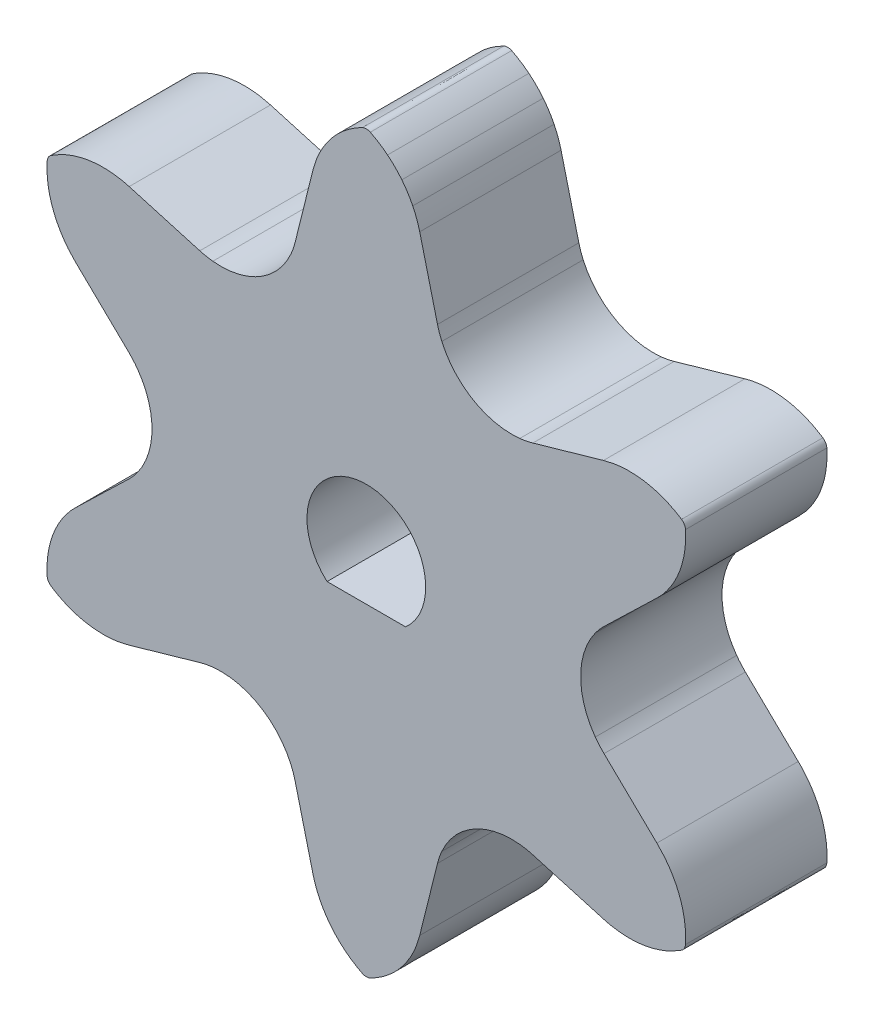
from build123d import *

# Parameters (mm, degrees)
BOSS_EXTRUDE1_DEPTH = 4.7625
CUT_EXTRUDE1_DEPTH  = 4.7625


with BuildPart() as part:
    # Sketch1 → Boss-Extrude1 (new body)
    with BuildSketch(Plane.XY):
        with BuildLine():
            ThreePointArc((0.13375119, -12.340042072), (1.193950707, -11.485860744), (1.798906697, -10.266157088))
            Line((1.798906697, -10.266157088), (2.398140588, -7.862761221))
            ThreePointArc((2.398140588, -7.862761221), (2.461635419, -7.64822635), (2.543491476, -7.440004377))
            ThreePointArc((2.543491476, -7.440004377), (3.61061, -6.253759966), (5.171487057, -5.922730421))
            ThreePointArc((5.171487057, -5.922730421), (5.392740604, -5.955951983), (5.610280667, -6.008231282))
            Line((5.610280667, -6.008231282), (7.991299489, -6.690977442))
            ThreePointArc((7.991299489, -6.690977442), (9.350071835, -6.776922016), (10.619914323, -6.285852964))
            ThreePointArc((10.619914323, -6.285852964), (10.714040096, -6.185753934), (10.753665513, -6.054189108))
            ThreePointArc((10.753665513, -6.054189108), (10.544022542, -4.708938729), (9.790206185, -3.575179646))
            Line((9.790206185, -3.575179646), (8.008421255, -1.854529939))
            ThreePointArc((8.008421255, -1.854529939), (7.854376023, -1.692274367), (7.714978533, -1.517273956))
            ThreePointArc((7.714978533, -1.517273956), (7.22122, 0), (7.714978533, 1.517273956))
            ThreePointArc((7.714978533, 1.517273956), (7.854376023, 1.692274367), (8.008421255, 1.854529939))
            Line((8.008421255, 1.854529939), (9.790205754, 3.575179229))
            ThreePointArc((9.790205754, 3.575179229), (10.544022434, 4.708938449), (10.753665513, 6.054189108))
            ThreePointArc((10.753665513, 6.054189108), (10.714040096, 6.185753934), (10.619914323, 6.285852964))
            ThreePointArc((10.619914323, 6.285852964), (9.350071835, 6.776922015), (7.991299489, 6.690977442))
            Line((7.991299489, 6.690977442), (5.610280667, 6.008231282))
            ThreePointArc((5.610280667, 6.008231282), (5.392740604, 5.955951983), (5.171487057, 5.922730421))
            ThreePointArc((5.171487057, 5.922730421), (3.61061, 6.253759966), (2.543491476, 7.440004377))
            ThreePointArc((2.543491476, 7.440004377), (2.461635419, 7.64822635), (2.398140588, 7.862761221))
            Line((2.398140588, 7.862761221), (1.798906697, 10.266157088))
            ThreePointArc((1.798906697, 10.266157088), (1.193950707, 11.485860744), (0.13375119, 12.340042072))
            ThreePointArc((0.13375119, 12.340042072), (0, 12.371507867), (-0.13375119, 12.340042072))
            ThreePointArc((-0.13375119, 12.340042072), (-1.193950707, 11.485860744), (-1.798906697, 10.266157088))
            Line((-1.798906697, 10.266157088), (-2.398140588, 7.862761221))
            ThreePointArc((-2.398140588, 7.862761221), (-2.461635419, 7.64822635), (-2.543491476, 7.440004377))
            ThreePointArc((-2.543491476, 7.440004377), (-3.61061, 6.253759966), (-5.171487057, 5.922730421))
            ThreePointArc((-5.171487057, 5.922730421), (-5.392740604, 5.955951983), (-5.610280667, 6.008231282))
            Line((-5.610280667, 6.008231282), (-7.991299489, 6.690977442))
            ThreePointArc((-7.991299489, 6.690977442), (-9.350071835, 6.776922016), (-10.619914323, 6.285852964))
            ThreePointArc((-10.619914323, 6.285852964), (-10.714040096, 6.185753934), (-10.753665513, 6.054189108))
            ThreePointArc((-10.753665513, 6.054189108), (-10.544022542, 4.708938729), (-9.790206185, 3.575179646))
            Line((-9.790206185, 3.575179646), (-8.008421255, 1.854529939))
            ThreePointArc((-8.008421255, 1.854529939), (-7.854376023, 1.692274367), (-7.714978533, 1.517273956))
            ThreePointArc((-7.714978533, 1.517273956), (-7.22122, 0), (-7.714978533, -1.517273956))
            ThreePointArc((-7.714978533, -1.517273956), (-7.854376023, -1.692274367), (-8.008421255, -1.854529939))
            Line((-8.008421255, -1.854529939), (-9.790205754, -3.575179229))
            ThreePointArc((-9.790205754, -3.575179229), (-10.544022434, -4.708938449), (-10.753665513, -6.054189108))
            ThreePointArc((-10.753665513, -6.054189108), (-10.714040096, -6.185753934), (-10.619914323, -6.285852964))
            ThreePointArc((-10.619914323, -6.285852964), (-9.350071835, -6.776922015), (-7.991299489, -6.690977442))
            Line((-7.991299489, -6.690977442), (-5.610280667, -6.008231282))
            ThreePointArc((-5.610280667, -6.008231282), (-5.392740604, -5.955951983), (-5.171487057, -5.922730421))
            ThreePointArc((-5.171487057, -5.922730421), (-3.61061, -6.253759966), (-2.543491476, -7.440004377))
            ThreePointArc((-2.543491476, -7.440004377), (-2.461635419, -7.64822635), (-2.398140588, -7.862761221))
            Line((-2.398140588, -7.862761221), (-1.798906697, -10.266157088))
            ThreePointArc((-1.798906697, -10.266157088), (-1.193950707, -11.485860744), (-0.13375119, -12.340042072))
            ThreePointArc((-0.13375119, -12.340042072), (0, -12.371507867), (0.13375119, -12.340042072))
        make_face()
        with BuildLine():
            Line((1.313392554, -1.475), (-1.313392554, -1.475))
            ThreePointArc((-1.313392554, -1.475), (0, 1.975), (1.313392554, -1.475))
        make_face(mode=Mode.SUBTRACT)
    extrude(amount=BOSS_EXTRUDE1_DEPTH)

    # Sketch2 → Cut-Extrude1 (cut)
    with BuildSketch(Plane.XY.offset(4.7625)):
        with BuildLine():
            Line((-1.322875656, -1.5), (1.322875656, -1.5))
            ThreePointArc((1.322875656, -1.5), (0, 2), (-1.322875656, -1.5))
        make_face()
    extrude(amount=-CUT_EXTRUDE1_DEPTH, mode=Mode.SUBTRACT)


solid = part.part
